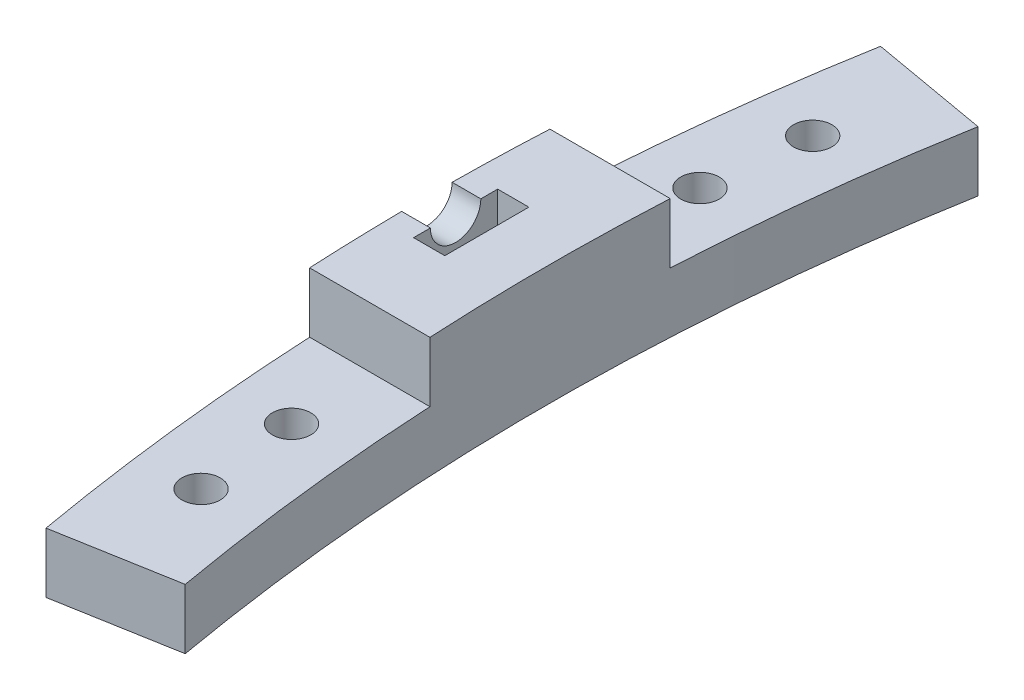
from build123d import *

# Parameters (mm, degrees)
BOSS_EXTRUDE1_DEPTH        = 5
BOSS_EXTRUDE2_DEPTH        = 5
SKETCH10_W                 = 7
SKETCH10_H                 = 7
CUT_EXTRUDE2_DEPTH         = 2.6
SKETCH11_R                 = 2.1
CUT_EXTRUDE3_DEPTH         = 37.99114612
F_3_2_3_2_DIAMETER_HOLE1_D = 3.2


with BuildPart() as part:
    # Sketch1 → Boss-Extrude1 (new body)
    with BuildSketch(Plane(origin=(0, 0, 0), x_dir=(1, 0, 0), z_dir=(0, 1, 0))):
        with BuildLine():
            Line((-196.961550602, 34.729635533), (-187.113473072, 32.993153757))
            ThreePointArc((-187.113473072, 32.993153757), (-190, 0), (-187.113473072, -32.993153757))
            Line((-187.113473072, -32.993153757), (-196.961550602, -34.729635533))
            ThreePointArc((-196.961550602, -34.729635533), (-200, 0), (-196.961550602, 34.729635533))
        make_face()
    extrude(amount=BOSS_EXTRUDE1_DEPTH)

    # Sketch9 → Boss-Extrude2 (add)
    with BuildSketch(Plane(origin=(0, 5, 0), x_dir=(1, 0, 0), z_dir=(0, 1, 0))):
        with BuildLine():
            Line((-199.749843554, 10), (-189.73665961, 10))
            ThreePointArc((-189.73665961, 10), (-190, 0), (-189.73665961, -10))
            Line((-189.73665961, -10), (-199.749843554, -10))
            ThreePointArc((-199.749843554, -10), (-200, 0), (-199.749843554, 10))
        make_face()
    extrude(amount=BOSS_EXTRUDE2_DEPTH)

    # Sketch10 → Cut-Extrude2 (cut)
    with BuildSketch(Plane.ZY.offset(195)):
        with Locations((0, 10)):
            Rectangle(SKETCH10_W, SKETCH10_H)
    extrude(amount=CUT_EXTRUDE2_DEPTH, mode=Mode.SUBTRACT)

    # Sketch11 → Cut-Extrude3 (cut, through all)
    with BuildSketch(Plane.ZY.offset(195)):
        with Locations((0, 10)):
            Circle(SKETCH11_R)
    extrude(amount=CUT_EXTRUDE3_DEPTH, mode=Mode.SUBTRACT)

    # Ø3.2 (3.2) Diameter Hole1 (through all)
    with Locations(Plane(origin=(0, 5, 0), x_dir=(1, 0, 0), z_dir=(0, 1, 0))):
        with Locations((-194.257966128, 16.995369836), (-193.331747968, 25.452607483), (-194.257966128, -16.995369836), (-193.331747968, -25.452607483)):
            Hole(F_3_2_3_2_DIAMETER_HOLE1_D / 2)


solid = part.part
